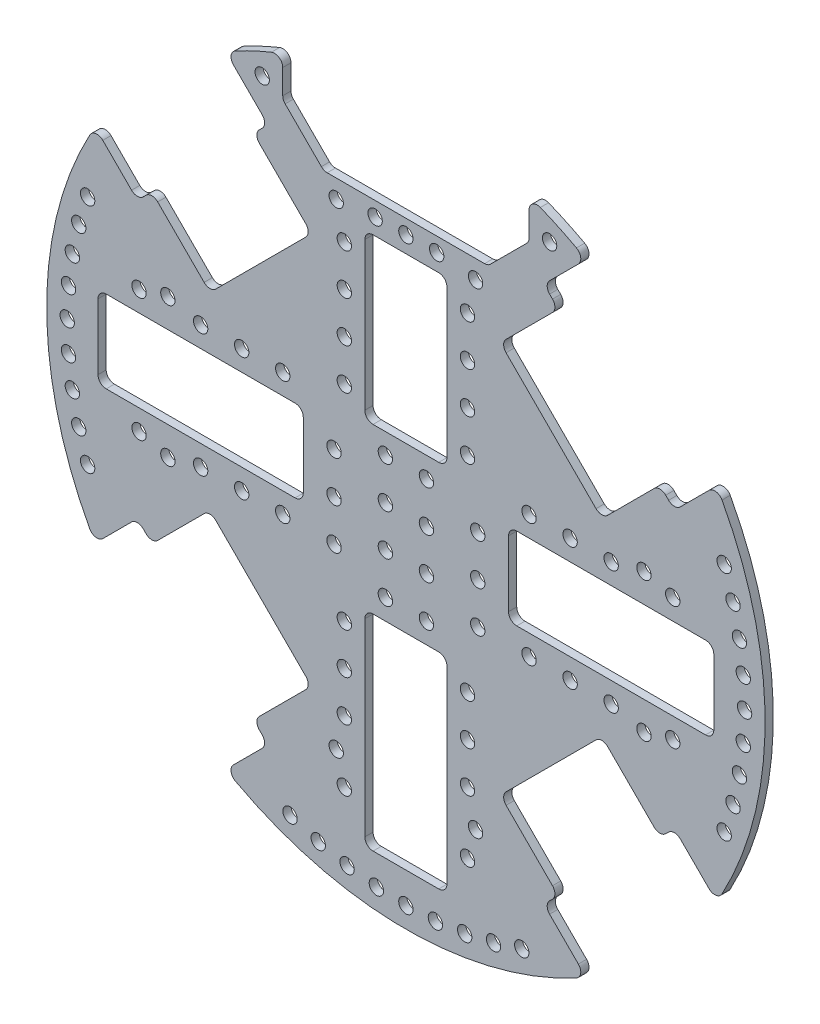
from build123d import *

# Parameters (mm, degrees)
SKETCH1_R                                  = 87.5
BOSS_EXTRUDE1_DEPTH                        = 2
CUT_EXTRUDE3_START                         = -124.759848093
CUT_EXTRUDE3_DEPTH                         = 125.759848093
SKETCH5_R                                  = 1.75
CUT_EXTRUDE4_DEPTH                         = 124.759848093
MIRROR3_START                              = -124.759848093
MIRROR3_AT_THE_SECOND_PLANE_COPY_1_DEPTH   = 125.759848093
MIRROR3_AT_THE_SECOND_PLANE_COPY_2_SKETC_R = 1.75
MIRROR3_AT_THE_SECOND_PLANE_COPY_2_DEPTH   = 124.759848093
CUT_EXTRUDE5_DEPTH                         = 124.759848093
SKETCH7_W                                  = 50
SKETCH7_H                                  = 20
SKETCH7_W_2                                = 20
SKETCH7_H_2                                = 50
SKETCH7_H_3                                = 40
CUT_EXTRUDE6_DEPTH                         = 124.759848093
FILLET1_R                                  = 2
SKETCH8_R                                  = 1.75
CUT_EXTRUDE7_DEPTH                         = 124.759848093
CIRPATTERN1_COUNT                          = 5
CIRPATTERN1_ANGLE                          = 20
CIRPATTERN1_THE_OTHER_WAY_COUNT            = 5
CIRPATTERN1_THE_OTHER_WAY_ANGLE            = 20
CIRPATTERN2_COUNT                          = 3
CIRPATTERN2_ANGLE                          = 180
CIRPATTERN2_COPY_1_SKETCH_R                = 1.75
CIRPATTERN2_COPY_1_DEPTH                   = 124.759848093
CIRPATTERN2_COPY_2_SKETCH_R                = 1.75
CIRPATTERN2_COPY_2_DEPTH                   = 124.759848093
CIRPATTERN2_COPY_3_SKETCH_R                = 1.75
CIRPATTERN2_COPY_3_DEPTH                   = 124.759848093
CIRPATTERN2_COPY_4_SKETCH_R                = 1.75
CIRPATTERN2_COPY_4_DEPTH                   = 124.759848093
CIRPATTERN2_COPY_5_SKETCH_R                = 1.75
CIRPATTERN2_COPY_5_DEPTH                   = 124.759848093
CIRPATTERN2_COPY_6_SKETCH_R                = 1.75
CIRPATTERN2_COPY_6_DEPTH                   = 124.759848093
CIRPATTERN2_COPY_7_SKETCH_R                = 1.75
CIRPATTERN2_COPY_7_DEPTH                   = 124.759848093
CIRPATTERN2_COPY_8_SKETCH_R                = 1.75
CIRPATTERN2_COPY_8_DEPTH                   = 124.759848093
CIRPATTERN2_COPY_9_SKETCH_R                = 1.75
CIRPATTERN2_COPY_9_DEPTH                   = 124.759848093
CIRPATTERN2_COPY_10_SKETCH_R               = 1.75
CIRPATTERN2_COPY_10_DEPTH                  = 124.759848093
CIRPATTERN2_COPY_11_SKETCH_R               = 1.75
CIRPATTERN2_COPY_11_DEPTH                  = 124.759848093
CIRPATTERN2_COPY_12_SKETCH_R               = 1.75
CIRPATTERN2_COPY_12_DEPTH                  = 124.759848093
CIRPATTERN2_COPY_13_SKETCH_R               = 1.75
CIRPATTERN2_COPY_13_DEPTH                  = 124.759848093
CIRPATTERN2_COPY_14_SKETCH_R               = 1.75
CIRPATTERN2_COPY_14_DEPTH                  = 124.759848093
CIRPATTERN2_COPY_15_SKETCH_R               = 1.75
CIRPATTERN2_COPY_15_DEPTH                  = 124.759848093
CIRPATTERN2_COPY_16_SKETCH_R               = 1.75
CIRPATTERN2_COPY_16_DEPTH                  = 124.759848093
SKETCH9_R                                  = 1.75
CUT_EXTRUDE8_DEPTH                         = 124.759848093
CIRPATTERN3_COUNT                          = 2
CIRPATTERN3_ANGLE                          = 90
SKETCH10_R                                 = 1.75
CUT_EXTRUDE9_DEPTH                         = 124.759848093
SKETCH11_R                                 = 1.75
CUT_EXTRUDE10_DEPTH                        = 124.759848093
SKETCH12_R                                 = 1.75
CUT_EXTRUDE11_DEPTH                        = 124.759848093
SKETCH13_R                                 = 1.75
CUT_EXTRUDE12_DEPTH                        = 124.759848093


with BuildPart() as part:
    # Sketch1 → Boss-Extrude1 (new body)
    with BuildSketch(Plane.XY):
        Circle(SKETCH1_R)
    extrude(amount=BOSS_EXTRUDE1_DEPTH)

    # Sketch4 → Cut-Extrude3 (cut)
    with BuildSketch(Plane.XY.offset(2).offset(CUT_EXTRUDE3_START)):
        Polygon((33.587572106, 65.40737726), (37.123106012, 61.871843354), (22.980970389, 47.72970773), (47.72970773, 22.980970389), (61.871843354, 37.123106012), (65.40737726, 33.587572106), (84.806371442, 52.986566289), (52.986566289, 84.806371442), align=None)
    cut_extrude3 = extrude(amount=CUT_EXTRUDE3_DEPTH, mode=Mode.SUBTRACT)

    # Sketch5 → Cut-Extrude4 (cut, through all)
    with BuildSketch(Plane(origin=(0, 0, 0), x_dir=(-1, 0, 0), z_dir=(0, 0, -1))):
        with Locations((-16.970562748, 57.982756057)):
            Circle(SKETCH5_R)
        with Locations((-57.982756057, 16.970562748)):
            Circle(SKETCH5_R)
    cut_extrude4 = extrude(amount=-CUT_EXTRUDE4_DEPTH, mode=Mode.SUBTRACT)

    # Mirror3: Cut-Extrude3, Cut-Extrude4 across plane
    add(cut_extrude3.mirror(Plane(origin=(0, 0, 0), x_dir=(0, 0, 1), z_dir=(1, 0, 0))), mode=Mode.SUBTRACT)
    add(cut_extrude4.mirror(Plane(origin=(0, 0, 0), x_dir=(0, 0, 1), z_dir=(1, 0, 0))), mode=Mode.SUBTRACT)

    # Mirror3 at the second plane: Cut-Extrude3, Cut-Extrude4 across plane
    add(cut_extrude3.mirror(Plane.ZX), mode=Mode.SUBTRACT)
    add(cut_extrude4.mirror(Plane.ZX), mode=Mode.SUBTRACT)

    # Mirror3 at the second plane copy 1 sketc → Mirror3 at the second plane copy 1 (cut)
    with BuildSketch(Plane(origin=(0, 0, 2), x_dir=(-1, 0, 0), z_dir=(0, 0, 1)).offset(MIRROR3_START)):
        Polygon((33.587572106, 65.40737726), (37.123106012, 61.871843354), (22.980970389, 47.72970773), (47.72970773, 22.980970389), (61.871843354, 37.123106012), (65.40737726, 33.587572106), (84.806371442, 52.986566289), (52.986566289, 84.806371442), align=None)
    extrude(amount=MIRROR3_AT_THE_SECOND_PLANE_COPY_1_DEPTH, mode=Mode.SUBTRACT)

    # Mirror3 at the second plane copy 2 sketc → Mirror3 at the second plane copy 2 (cut, through all)
    with BuildSketch(Plane(origin=(0, 0, 0), x_dir=(1, 0, 0), z_dir=(0, 0, -1))):
        with Locations((-16.970562748, 57.982756057)):
            Circle(MIRROR3_AT_THE_SECOND_PLANE_COPY_2_SKETC_R)
        with Locations((-57.982756057, 16.970562748)):
            Circle(MIRROR3_AT_THE_SECOND_PLANE_COPY_2_SKETC_R)
    extrude(amount=-MIRROR3_AT_THE_SECOND_PLANE_COPY_2_DEPTH, mode=Mode.SUBTRACT)

    # Sketch6 → Cut-Extrude5 (cut, through all)
    with BuildSketch(Plane(origin=(0, 0, 0), x_dir=(-1, 0, 0), z_dir=(0, 0, -1))):
        Polygon((-30, 72.5), (-20, 62.5), (20, 62.5), (30, 72.5), (30, 87.5), (-30, 87.5), align=None)
    extrude(amount=-CUT_EXTRUDE5_DEPTH, mode=Mode.SUBTRACT)

    # Sketch7 → Cut-Extrude6 (cut, through all)
    with BuildSketch(Plane(origin=(0, 0, 0), x_dir=(-1, 0, 0), z_dir=(0, 0, -1))):
        with Locations((-50, 0)):
            Rectangle(SKETCH7_W, SKETCH7_H)
        with Locations((50, 0)):
            Rectangle(SKETCH7_W, SKETCH7_H)
        with Locations((0, -50)):
            Rectangle(SKETCH7_W_2, SKETCH7_H_2)
        with Locations((0, 35)):
            Rectangle(SKETCH7_W_2, SKETCH7_H_3)
    extrude(amount=-CUT_EXTRUDE6_DEPTH, mode=Mode.SUBTRACT)

    # Fillet1
    fillet1_edges = [part.edges().sort_by_distance(p)[0] for p in [
        (-43.881401139, -75.701206292, 1),
        (-75.701206292, -43.881401139, 1),
        (-47.72970773, -22.980970389, 1),
        (-61.871843354, -37.123106012, 1),
        (-65.40737726, -33.587572106, 1),
        (-33.587572106, -65.40737726, 1),
        (-37.123106012, -61.871843354, 1),
        (-22.980970389, -47.72970773, 1),
        (65.40737726, 33.587572106, 1),
        (43.881401139, 75.701206292, 1),
        (47.72970773, 22.980970389, 1),
        (61.871843354, 37.123106012, 1),
        (75.701206292, 43.881401139, 1),
        (33.587572106, 65.40737726, 1),
        (37.123106012, 61.871843354, 1),
        (22.980970389, 47.72970773, 1),
        (-30, 82.196411114, 1),
        (30, 82.196411114, 1),
        (30, 72.5, 1),
        (-30, 72.5, 1),
        (-20, 62.5, 1),
        (20, 62.5, 1),
        (25, 10, 1),
        (25, -10, 1),
        (75, -10, 1),
        (75, 10, 1),
        (-25, -10, 1),
        (-25, 10, 1),
        (-75, 10, 1),
        (-75, -10, 1),
        (-10, -25, 1),
        (-10, -75, 1),
        (10, -75, 1),
        (10, -25, 1),
        (-10, 55, 1),
        (-10, 15, 1),
        (10, 15, 1),
        (10, 55, 1),
        (33.587572106, -65.40737726, 1),
        (75.701206292, -43.881401139, 1),
        (61.871843354, -37.123106012, 1),
        (47.72970773, -22.980970389, 1),
        (22.980970389, -47.72970773, 1),
        (37.123106012, -61.871843354, 1),
        (43.881401139, -75.701206292, 1),
        (65.40737726, -33.587572106, 1),
        (-33.587572106, 65.40737726, 1),
        (-75.701206292, 43.881401139, 1),
        (-61.871843354, 37.123106012, 1),
        (-47.72970773, 22.980970389, 1),
        (-22.980970389, 47.72970773, 1),
        (-37.123106012, 61.871843354, 1),
        (-43.881401139, 75.701206292, 1),
        (-65.40737726, 33.587572106, 1),
    ]]
    fillet(fillet1_edges, radius=FILLET1_R)

    # Sketch8 → Cut-Extrude7 (cut, through all)
    with BuildSketch(Plane(origin=(0, 0, 0), x_dir=(-1, 0, 0), z_dir=(0, 0, -1))):
        with Locations((-82.5, 0)):
            Circle(SKETCH8_R)
    cut_extrude7 = extrude(amount=-CUT_EXTRUDE7_DEPTH, mode=Mode.SUBTRACT)

    # CirPattern1: Cut-Extrude7 ×5 about axis
    cirpattern1_axis = Axis((0, 0, 0), (0, 0, 1))
    for i in range(1, CIRPATTERN1_COUNT):
        add(cut_extrude7.rotate(cirpattern1_axis, i * CIRPATTERN1_ANGLE / (CIRPATTERN1_COUNT - 1)), mode=Mode.SUBTRACT)

    # CirPattern1 the other way: Cut-Extrude7 ×5 about axis
    cirpattern1_the_other_way_axis = Axis((0, 0, 0), (0, 0, -1))
    for i in range(1, CIRPATTERN1_THE_OTHER_WAY_COUNT):
        add(cut_extrude7.rotate(cirpattern1_the_other_way_axis, i * CIRPATTERN1_THE_OTHER_WAY_ANGLE / (CIRPATTERN1_THE_OTHER_WAY_COUNT - 1)), mode=Mode.SUBTRACT)

    # CirPattern2: Cut-Extrude7 ×3 about axis
    cirpattern2_axis = Axis((0, 0, 0), (0, 0, -1))
    for i in range(1, CIRPATTERN2_COUNT):
        add(cut_extrude7.rotate(cirpattern2_axis, i * CIRPATTERN2_ANGLE / (CIRPATTERN2_COUNT - 1)), mode=Mode.SUBTRACT)

    # CirPattern2 copy 1 sketch → CirPattern2 copy 1 (cut, through all)
    with BuildSketch(Plane(origin=(0, 0, 0), x_dir=(-0.08715574274765489, 0.9961946980917459, 0), z_dir=(0, 0, -1))):
        with Locations((-82.5, 0)):
            Circle(CIRPATTERN2_COPY_1_SKETCH_R)
    extrude(amount=-CIRPATTERN2_COPY_1_DEPTH, mode=Mode.SUBTRACT)

    # CirPattern2 copy 2 sketch → CirPattern2 copy 2 (cut, through all)
    with BuildSketch(Plane(origin=(0, 0, 0), x_dir=(0.9961946980917461, 0.08715574274765142, 0), z_dir=(0, 0, -1))):
        with Locations((-82.5, 0)):
            Circle(CIRPATTERN2_COPY_2_SKETCH_R)
    extrude(amount=-CIRPATTERN2_COPY_2_DEPTH, mode=Mode.SUBTRACT)

    # CirPattern2 copy 3 sketch → CirPattern2 copy 3 (cut, through all)
    with BuildSketch(Plane(origin=(0, 0, 0), x_dir=(-0.1736481776669273, 0.9848077530122086, 0), z_dir=(0, 0, -1))):
        with Locations((-82.5, 0)):
            Circle(CIRPATTERN2_COPY_3_SKETCH_R)
    extrude(amount=-CIRPATTERN2_COPY_3_DEPTH, mode=Mode.SUBTRACT)

    # CirPattern2 copy 4 sketch → CirPattern2 copy 4 (cut, through all)
    with BuildSketch(Plane(origin=(0, 0, 0), x_dir=(0.9848077530122092, 0.17364817766692386, 0), z_dir=(0, 0, -1))):
        with Locations((-82.5, 0)):
            Circle(CIRPATTERN2_COPY_4_SKETCH_R)
    extrude(amount=-CIRPATTERN2_COPY_4_DEPTH, mode=Mode.SUBTRACT)

    # CirPattern2 copy 5 sketch → CirPattern2 copy 5 (cut, through all)
    with BuildSketch(Plane(origin=(0, 0, 0), x_dir=(-0.258819045102518, 0.965925826289069, 0), z_dir=(0, 0, -1))):
        with Locations((-82.5, 0)):
            Circle(CIRPATTERN2_COPY_5_SKETCH_R)
    extrude(amount=-CIRPATTERN2_COPY_5_DEPTH, mode=Mode.SUBTRACT)

    # CirPattern2 copy 6 sketch → CirPattern2 copy 6 (cut, through all)
    with BuildSketch(Plane(origin=(0, 0, 0), x_dir=(0.9659258262890699, 0.25881904510251463, 0), z_dir=(0, 0, -1))):
        with Locations((-82.5, 0)):
            Circle(CIRPATTERN2_COPY_6_SKETCH_R)
    extrude(amount=-CIRPATTERN2_COPY_6_DEPTH, mode=Mode.SUBTRACT)

    # CirPattern2 copy 7 sketch → CirPattern2 copy 7 (cut, through all)
    with BuildSketch(Plane(origin=(0, 0, 0), x_dir=(-0.3420201433256662, 0.9396926207859093, 0), z_dir=(0, 0, -1))):
        with Locations((-82.5, 0)):
            Circle(CIRPATTERN2_COPY_7_SKETCH_R)
    extrude(amount=-CIRPATTERN2_COPY_7_DEPTH, mode=Mode.SUBTRACT)

    # CirPattern2 copy 8 sketch → CirPattern2 copy 8 (cut, through all)
    with BuildSketch(Plane(origin=(0, 0, 0), x_dir=(0.9396926207859105, 0.34202014332566294, 0), z_dir=(0, 0, -1))):
        with Locations((-82.5, 0)):
            Circle(CIRPATTERN2_COPY_8_SKETCH_R)
    extrude(amount=-CIRPATTERN2_COPY_8_DEPTH, mode=Mode.SUBTRACT)

    # CirPattern2 copy 9 sketch → CirPattern2 copy 9 (cut, through all)
    with BuildSketch(Plane(origin=(0, 0, 0), x_dir=(0.08715574274766186, 0.9961946980917452, 0), z_dir=(0, 0, -1))):
        with Locations((-82.5, 0)):
            Circle(CIRPATTERN2_COPY_9_SKETCH_R)
    extrude(amount=-CIRPATTERN2_COPY_9_DEPTH, mode=Mode.SUBTRACT)

    # CirPattern2 copy 10 sketch → CirPattern2 copy 10 (cut, through all)
    with BuildSketch(Plane(origin=(0, 0, 0), x_dir=(0.996194698091745, -0.08715574274766533, 0), z_dir=(0, 0, -1))):
        with Locations((-82.5, 0)):
            Circle(CIRPATTERN2_COPY_10_SKETCH_R)
    extrude(amount=-CIRPATTERN2_COPY_10_DEPTH, mode=Mode.SUBTRACT)

    # CirPattern2 copy 11 sketch → CirPattern2 copy 11 (cut, through all)
    with BuildSketch(Plane(origin=(0, 0, 0), x_dir=(0.1736481776669342, 0.9848077530122075, 0), z_dir=(0, 0, -1))):
        with Locations((-82.5, 0)):
            Circle(CIRPATTERN2_COPY_11_SKETCH_R)
    extrude(amount=-CIRPATTERN2_COPY_11_DEPTH, mode=Mode.SUBTRACT)

    # CirPattern2 copy 12 sketch → CirPattern2 copy 12 (cut, through all)
    with BuildSketch(Plane(origin=(0, 0, 0), x_dir=(0.9848077530122068, -0.17364817766693763, 0), z_dir=(0, 0, -1))):
        with Locations((-82.5, 0)):
            Circle(CIRPATTERN2_COPY_12_SKETCH_R)
    extrude(amount=-CIRPATTERN2_COPY_12_DEPTH, mode=Mode.SUBTRACT)

    # CirPattern2 copy 13 sketch → CirPattern2 copy 13 (cut, through all)
    with BuildSketch(Plane(origin=(0, 0, 0), x_dir=(0.2588190451025248, 0.9659258262890672, 0), z_dir=(0, 0, -1))):
        with Locations((-82.5, 0)):
            Circle(CIRPATTERN2_COPY_13_SKETCH_R)
    extrude(amount=-CIRPATTERN2_COPY_13_DEPTH, mode=Mode.SUBTRACT)

    # CirPattern2 copy 14 sketch → CirPattern2 copy 14 (cut, through all)
    with BuildSketch(Plane(origin=(0, 0, 0), x_dir=(0.9659258262890663, -0.2588190451025282, 0), z_dir=(0, 0, -1))):
        with Locations((-82.5, 0)):
            Circle(CIRPATTERN2_COPY_14_SKETCH_R)
    extrude(amount=-CIRPATTERN2_COPY_14_DEPTH, mode=Mode.SUBTRACT)

    # CirPattern2 copy 15 sketch → CirPattern2 copy 15 (cut, through all)
    with BuildSketch(Plane(origin=(0, 0, 0), x_dir=(0.34202014332567277, 0.9396926207859069, 0), z_dir=(0, 0, -1))):
        with Locations((-82.5, 0)):
            Circle(CIRPATTERN2_COPY_15_SKETCH_R)
    extrude(amount=-CIRPATTERN2_COPY_15_DEPTH, mode=Mode.SUBTRACT)

    # CirPattern2 copy 16 sketch → CirPattern2 copy 16 (cut, through all)
    with BuildSketch(Plane(origin=(0, 0, 0), x_dir=(0.9396926207859057, -0.34202014332567604, 0), z_dir=(0, 0, -1))):
        with Locations((-82.5, 0)):
            Circle(CIRPATTERN2_COPY_16_SKETCH_R)
    extrude(amount=-CIRPATTERN2_COPY_16_DEPTH, mode=Mode.SUBTRACT)

    # Sketch9 → Cut-Extrude8 (cut, through all)
    with BuildSketch(Plane(origin=(0, 0, 0), x_dir=(-1, 0, 0), z_dir=(0, 0, -1))):
        with Locations((-50, 15)):
            Circle(SKETCH9_R)
        with Locations((50, 15)):
            Circle(SKETCH9_R)
        with Locations((50, -15)):
            Circle(SKETCH9_R)
        with Locations((-50, -15)):
            Circle(SKETCH9_R)
        with Locations((-40, 15)):
            Circle(SKETCH9_R)
        with Locations((-40, -15)):
            Circle(SKETCH9_R)
        with Locations((-30, 15)):
            Circle(SKETCH9_R)
        with Locations((-30, -15)):
            Circle(SKETCH9_R)
        with Locations((40, 15)):
            Circle(SKETCH9_R)
        with Locations((40, -15)):
            Circle(SKETCH9_R)
        with Locations((30, 15)):
            Circle(SKETCH9_R)
        with Locations((30, -15)):
            Circle(SKETCH9_R)
        with Locations((-65, 15)):
            Circle(SKETCH9_R)
        with Locations((-65, -15)):
            Circle(SKETCH9_R)
        with Locations((65, 15)):
            Circle(SKETCH9_R)
        with Locations((65, -15)):
            Circle(SKETCH9_R)
    cut_extrude8 = extrude(amount=-CUT_EXTRUDE8_DEPTH, mode=Mode.SUBTRACT)

    # CirPattern3: Cut-Extrude8 ×2 about axis
    cirpattern3_axis = Axis((0, 0, 0), (0, 0, 1))
    for i in range(1, CIRPATTERN3_COUNT):
        add(cut_extrude8.rotate(cirpattern3_axis, i * CIRPATTERN3_ANGLE / (CIRPATTERN3_COUNT - 1)), mode=Mode.SUBTRACT)

    # Sketch10 → Cut-Extrude9 (cut, through all)
    with BuildSketch(Plane(origin=(0, 0, 0), x_dir=(-1, 0, 0), z_dir=(0, 0, -1))):
        with Locations((-5, -20)):
            Circle(SKETCH10_R)
        with Locations((5, -20)):
            Circle(SKETCH10_R)
        with Locations((5, -10)):
            Circle(SKETCH10_R)
        with Locations((-5, -10)):
            Circle(SKETCH10_R)
        with Locations((5, 0)):
            Circle(SKETCH10_R)
        with Locations((-5, 0)):
            Circle(SKETCH10_R)
        with Locations((5, 10)):
            Circle(SKETCH10_R)
        with Locations((-5, 10)):
            Circle(SKETCH10_R)
    extrude(amount=-CUT_EXTRUDE9_DEPTH, mode=Mode.SUBTRACT)

    # Sketch11 → Cut-Extrude10 (cut, through all)
    with BuildSketch(Plane(origin=(0, 0, 0), x_dir=(-1, 0, 0), z_dir=(0, 0, -1))):
        with Locations((-17.5, 5)):
            Circle(SKETCH11_R)
        with Locations((17.5, 5)):
            Circle(SKETCH11_R)
        with Locations((-17.5, -5)):
            Circle(SKETCH11_R)
        with Locations((17.5, -5)):
            Circle(SKETCH11_R)
        with Locations((-17.5, -15)):
            Circle(SKETCH11_R)
        with Locations((17.5, -15)):
            Circle(SKETCH11_R)
    extrude(amount=-CUT_EXTRUDE10_DEPTH, mode=Mode.SUBTRACT)

    # Sketch12 → Cut-Extrude11 (cut, through all)
    with BuildSketch(Plane(origin=(0, 0, 0), x_dir=(-1, 0, 0), z_dir=(0, 0, -1))):
        with Locations((-15, 20)):
            Circle(SKETCH12_R)
        with Locations((15, 20)):
            Circle(SKETCH12_R)
    extrude(amount=-CUT_EXTRUDE11_DEPTH, mode=Mode.SUBTRACT)

    # Sketch13 → Cut-Extrude12 (cut, through all)
    with BuildSketch(Plane(origin=(0, 0, 0), x_dir=(-1, 0, 0), z_dir=(0, 0, -1))):
        with Locations((-35, 75)):
            Circle(SKETCH13_R)
        with Locations((35, 75)):
            Circle(SKETCH13_R)
        with Locations((0, 59)):
            Circle(SKETCH13_R)
        with Locations((7.5, 59)):
            Circle(SKETCH13_R)
        with Locations((-7.5, 59)):
            Circle(SKETCH13_R)
    extrude(amount=-CUT_EXTRUDE12_DEPTH, mode=Mode.SUBTRACT)


solid = part.part
